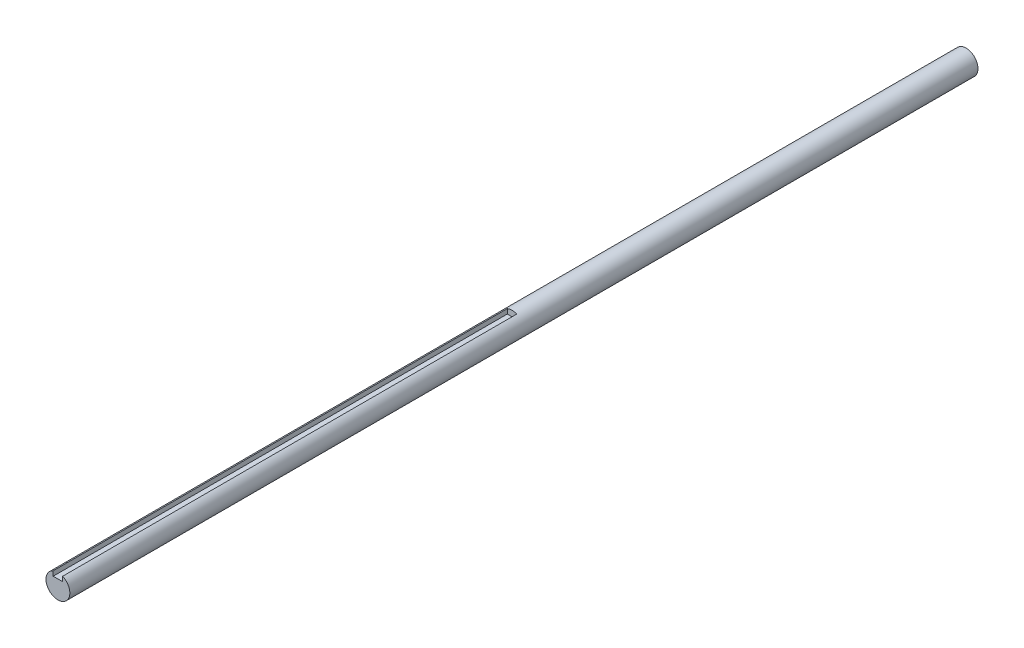
from build123d import *
from build123d.topology import SkipClean

# Parameters (mm, degrees)
SKETCH1_R           = 2
BOSS_EXTRUDE1_DEPTH = 76.2
BOSS_EXTRUDE2_DEPTH = 76.2


with BuildPart() as part:
    # Sketch1 → Boss-Extrude1 (new body)
    with BuildSketch(Plane.XY):
        with Locations(Location((0, 0, 0), (0, 0, 180))):
            Circle(SKETCH1_R)
    extrude(amount=BOSS_EXTRUDE1_DEPTH)

    # Sketch2 → Boss-Extrude2 (add)
    with SkipClean():  # the faces are left unmerged after this step: merging them gives an invalid solid
        with BuildSketch(Plane.XY.offset(76.2)):
            with BuildLine():
                Line((-0.79375, 1.835745336), (-0.79375, 1.0475))
                Line((-0.79375, 1.0475), (0.79375, 1.0475))
                Line((0.79375, 1.0475), (0.79375, 1.835745336))
                ThreePointArc((0.79375, 1.835745336), (0, -2), (-0.79375, 1.835745336))
            make_face()
        extrude(amount=BOSS_EXTRUDE2_DEPTH)


solid = part.part
